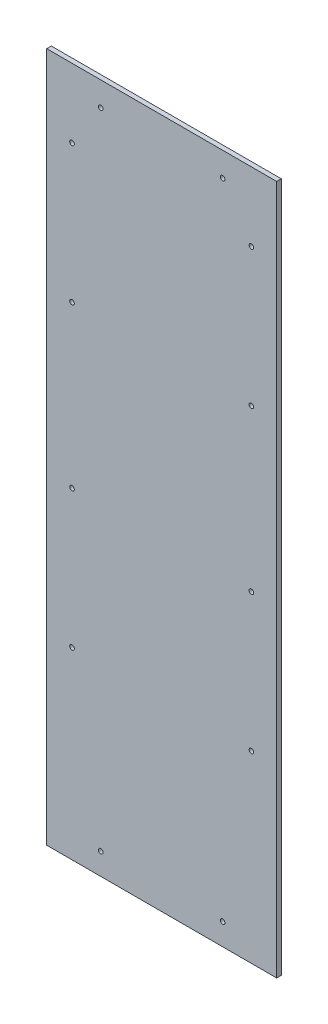
from build123d import *

# Parameters (mm, degrees)
SKETCH1_W           = 100
SKETCH1_H           = 300
BOSS_EXTRUDE1_DEPTH = 2
SKETCH2_R           = 1
CUT_EXTRUDE1_DEPTH  = 10
SKETCH3_R           = 1
CUT_EXTRUDE2_DEPTH  = 10


with BuildPart() as part:
    # Sketch1 → Boss-Extrude1 (new body)
    with BuildSketch(Plane.XY):
        Rectangle(SKETCH1_W, SKETCH1_H)
    extrude(amount=BOSS_EXTRUDE1_DEPTH)

    # Sketch2 → Cut-Extrude1 (cut)
    with BuildSketch(Plane.XY.offset(2)):
        with Locations((-39, 120)):
            Circle(SKETCH2_R)
        with Locations((-39, 60)):
            Circle(SKETCH2_R)
        with Locations((-39, -10)):
            Circle(SKETCH2_R)
        with Locations((-39, -70)):
            Circle(SKETCH2_R)
        with Locations((39, -70)):
            Circle(SKETCH2_R)
        with Locations((39, -10)):
            Circle(SKETCH2_R)
        with Locations((39, 60)):
            Circle(SKETCH2_R)
        with Locations((39, 120)):
            Circle(SKETCH2_R)
    extrude(amount=-CUT_EXTRUDE1_DEPTH, mode=Mode.SUBTRACT)

    # Sketch3 → Cut-Extrude2 (cut)
    with BuildSketch(Plane.XY.offset(2)):
        with Locations((-26.5, -140.5)):
            Circle(SKETCH3_R)
        with Locations((26.5, -140.5)):
            Circle(SKETCH3_R)
        with Locations((-26.5, 139.5)):
            Circle(SKETCH3_R)
        with Locations((26.5, 139.5)):
            Circle(SKETCH3_R)
    extrude(amount=-CUT_EXTRUDE2_DEPTH, mode=Mode.SUBTRACT)


solid = part.part
